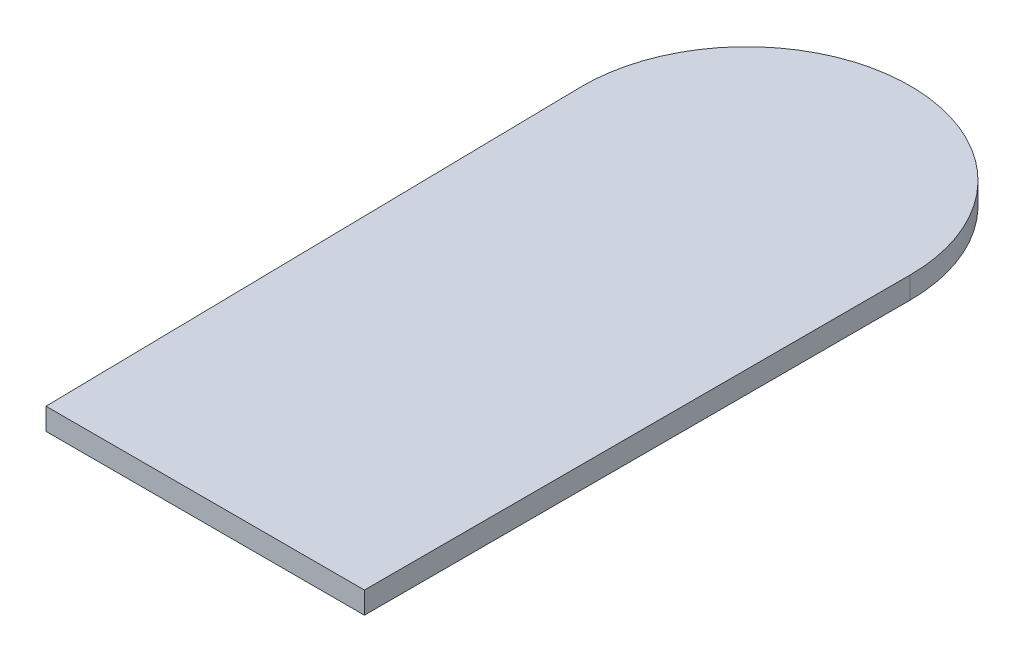
from build123d import *

# Parameters (mm, degrees)
BOSS_EXTRUDE1_DEPTH = 3


with BuildPart() as part:
    # Sketch1 → Boss-Extrude1 (new body)
    with BuildSketch(Plane(origin=(0, 0, 0), x_dir=(1, 0, 0), z_dir=(0, 1, 0))):
        with BuildLine():
            Line((-22.49688003, -0.374685064), (-21.25399698, -75))
            Line((-21.25399698, -75), (22.5, -75))
            Line((22.5, -75), (22.5, 0))
            ThreePointArc((22.5, 0), (-0.187349027, 22.499219994), (-22.49688003, -0.374685064))
        make_face()
    extrude(amount=BOSS_EXTRUDE1_DEPTH)


solid = part.part
